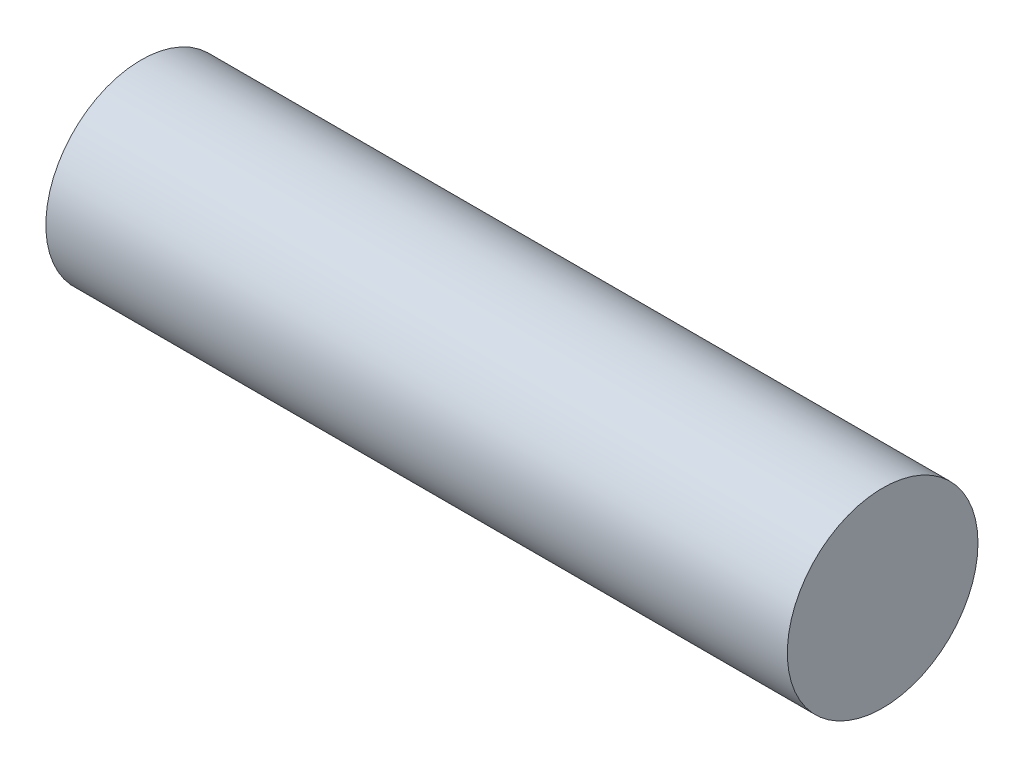
from build123d import *

# Parameters (mm, degrees)
SKETCH1_R           = 9
BOSS_EXTRUDE1_DEPTH = 70


with BuildPart() as part:
    # Sketch1 → Boss-Extrude1 (new body)
    with BuildSketch(Plane.YZ):
        with Locations(Location((0, 0, 0), (0, 0, 270))):
            Circle(SKETCH1_R)
    extrude(amount=BOSS_EXTRUDE1_DEPTH)


solid = part.part
